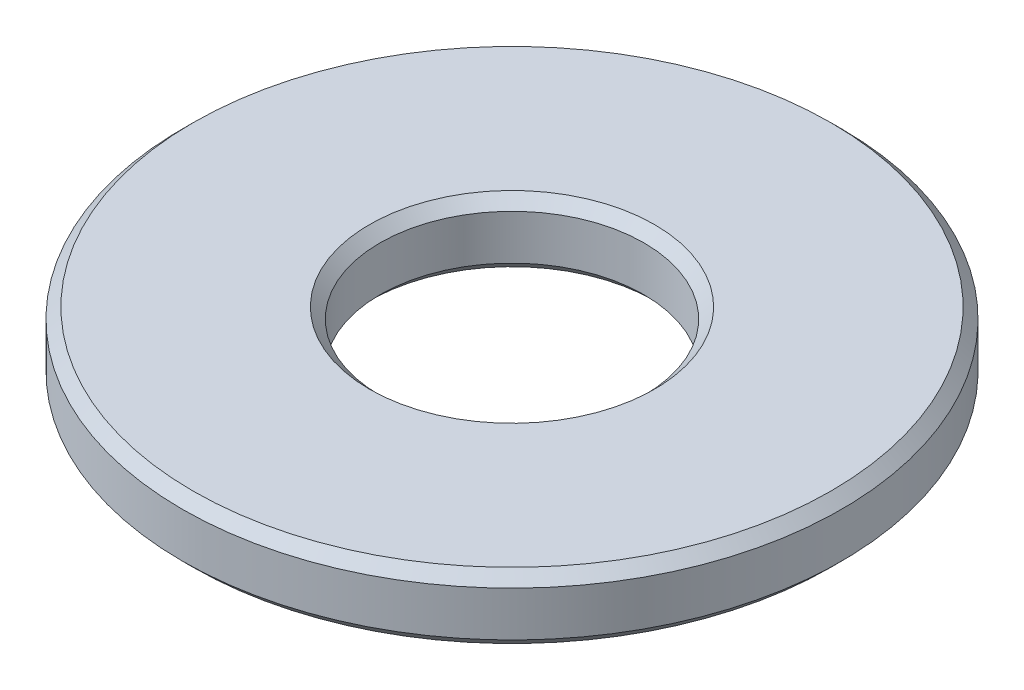
from build123d import *

# Parameters (mm, degrees)
SKETCH1_W     = 2.3749
SKETCH1_H     = 0.79375
CHAMFER1_SIZE = 0.127


with BuildPart() as part:
    # Sketch1 → Revolve1 (revolve)
    with BuildSketch(Plane.XY, mode=Mode.PRIVATE) as revolve1_sk:
        with Locations((2.77495, 0)):
            Rectangle(SKETCH1_W, SKETCH1_H)
    revolve(revolve1_sk.sketch.rotate(Axis((0, 3.40958908, 0), (0, -1, 0)), 90), axis=Axis((0, 3.40958908, 0), (0, -1, 0)))

    # Chamfer1
    chamfer1_edges = [part.edges().sort_by_distance(p)[0] for p in [
        (0, 0.396875, -3.9624),
        (0, -0.396875, -3.9624),
        (0, -0.396875, -1.5875),
        (0, 0.396875, -1.5875),
    ]]
    chamfer(chamfer1_edges, length=CHAMFER1_SIZE)


solid = part.part
